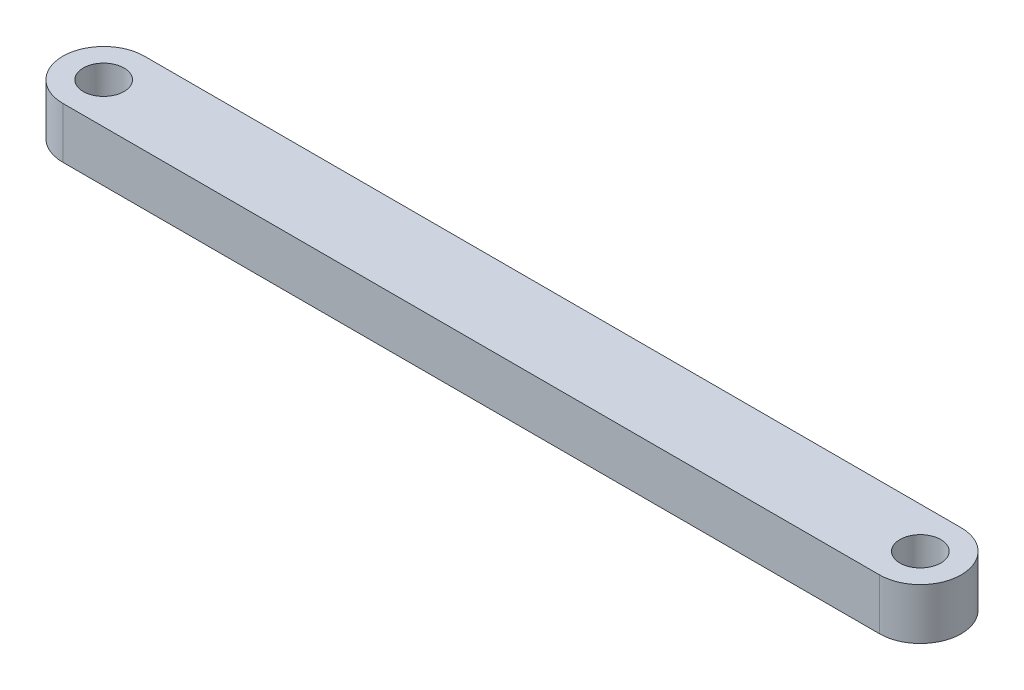
from build123d import *

# Parameters (mm, degrees)
BOSS_EXTRUDE1_DEPTH = 2.5
SKETCH2_R           = 1
CUT_EXTRUDE1_DEPTH  = 23.231734075


with BuildPart() as part:
    # Sketch1 → Boss-Extrude1 (new body)
    with BuildSketch(Plane(origin=(0, 0, 0), x_dir=(1, 0, 0), z_dir=(0, 1, 0))):
        with BuildLine():
            ThreePointArc((-20, 2), (-22, 0), (-20, -2))
            Line((-20, -2), (-20, 2))
        make_face()
        with BuildLine():
            Line((-20, 2), (-20, -2))
            ThreePointArc((-20, -2), (-18.585786438, -1.414213562), (-18, 0))
            ThreePointArc((-18, 0), (-18.585786438, 1.414213562), (-20, 2))
        make_face()
        with BuildLine():
            ThreePointArc((-18, 0), (-18.585786438, -1.414213562), (-20, -2))
            Line((-20, -2), (20, -2))
            ThreePointArc((20, -2), (18, 0), (20, 2))
            Line((20, 2), (-20, 2))
            ThreePointArc((-20, 2), (-18.585786438, 1.414213562), (-18, 0))
        make_face()
        with BuildLine():
            ThreePointArc((20, 2), (18, 0), (20, -2))
            Line((20, -2), (20, 2))
        make_face()
        with BuildLine():
            Line((20, 2), (20, -2))
            ThreePointArc((20, -2), (21.414213562, -1.414213562), (22, 0))
            ThreePointArc((22, 0), (21.414213562, 1.414213562), (20, 2))
        make_face()
    extrude(amount=BOSS_EXTRUDE1_DEPTH)

    # Sketch2 → Cut-Extrude1 (cut, through all)
    with BuildSketch(Plane(origin=(0, 0, 0), x_dir=(1, 0, 0), z_dir=(0, 1, 0))):
        with Locations(Location((20, 0, 0), (0, 0, 270))):
            Circle(SKETCH2_R)
        with Locations(Location((-20, 0, 0), (0, 0, 270))):
            Circle(SKETCH2_R)
    extrude(amount=CUT_EXTRUDE1_DEPTH, mode=Mode.SUBTRACT)


solid = part.part
